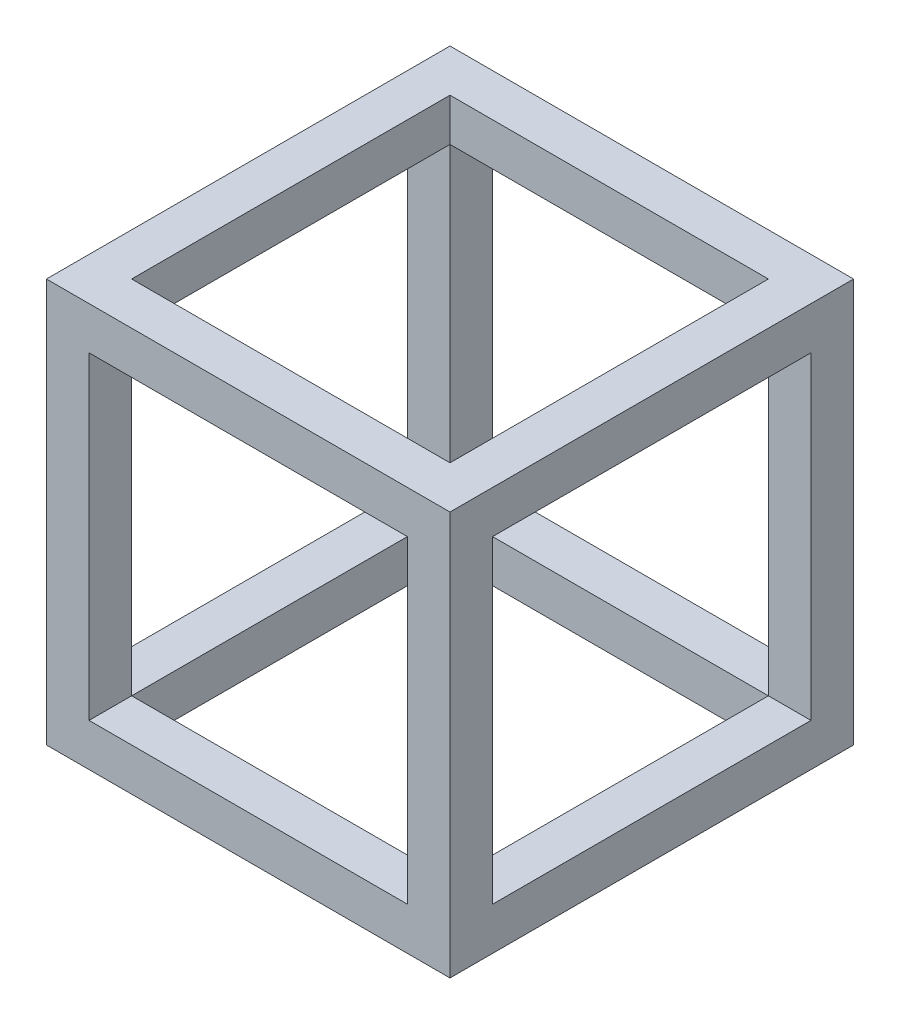
from build123d import *

# Parameters (mm, degrees)
SKETCH1_W               = 228.6
SKETCH1_H               = 228.6
BOSS_EXTRUDE1_DEPTH     = 228.6
CUT_EXTRUDE2_DEPTH      = 396.94681461
CUT_EXTRUDE2_DEPTH_BACK = 396.94681461
SKETCH2_W               = 180.34
SKETCH2_H               = 180.34
SKETCH3_W               = 180.34
SKETCH3_H               = 180.34
CUT_EXTRUDE4_DEPTH      = 396.94681461
SKETCH4_W               = 180.34
SKETCH4_H               = 180.34
CUT_EXTRUDE5_DEPTH      = 396.94681461


with BuildPart() as part:
    # Sketch1 → Boss-Extrude1 (new body)
    with BuildSketch(Plane(origin=(0, 0, 0), x_dir=(1, 0, 0), z_dir=(0, 1, 0))):
        with Locations((114.3, -114.3)):
            Rectangle(SKETCH1_W, SKETCH1_H)
    extrude(amount=BOSS_EXTRUDE1_DEPTH)

    # Sketch2 → Cut-Extrude2 (cut, two sides: drawn at the far end of the back side and taken through both)
    with BuildSketch(Plane.XY.offset(-CUT_EXTRUDE2_DEPTH_BACK)):
        with Locations((114.3, 114.3)):
            Rectangle(SKETCH2_W, SKETCH2_H)
    extrude(amount=CUT_EXTRUDE2_DEPTH + CUT_EXTRUDE2_DEPTH_BACK, mode=Mode.SUBTRACT)

    # Sketch3 → Cut-Extrude4 (cut, through all)
    with BuildSketch(Plane(origin=(0, 0, 0), x_dir=(0, 0, -1), z_dir=(1, 0, 0))):
        with Locations((-114.3, 114.3)):
            Rectangle(SKETCH3_W, SKETCH3_H)
    extrude(amount=CUT_EXTRUDE4_DEPTH, mode=Mode.SUBTRACT)

    # Sketch4 → Cut-Extrude5 (cut, through all)
    with BuildSketch(Plane(origin=(0, 0, 0), x_dir=(1, 0, 0), z_dir=(0, 1, 0))):
        with Locations((114.3, -114.3)):
            Rectangle(SKETCH4_W, SKETCH4_H)
    extrude(amount=CUT_EXTRUDE5_DEPTH, mode=Mode.SUBTRACT)


solid = part.part
